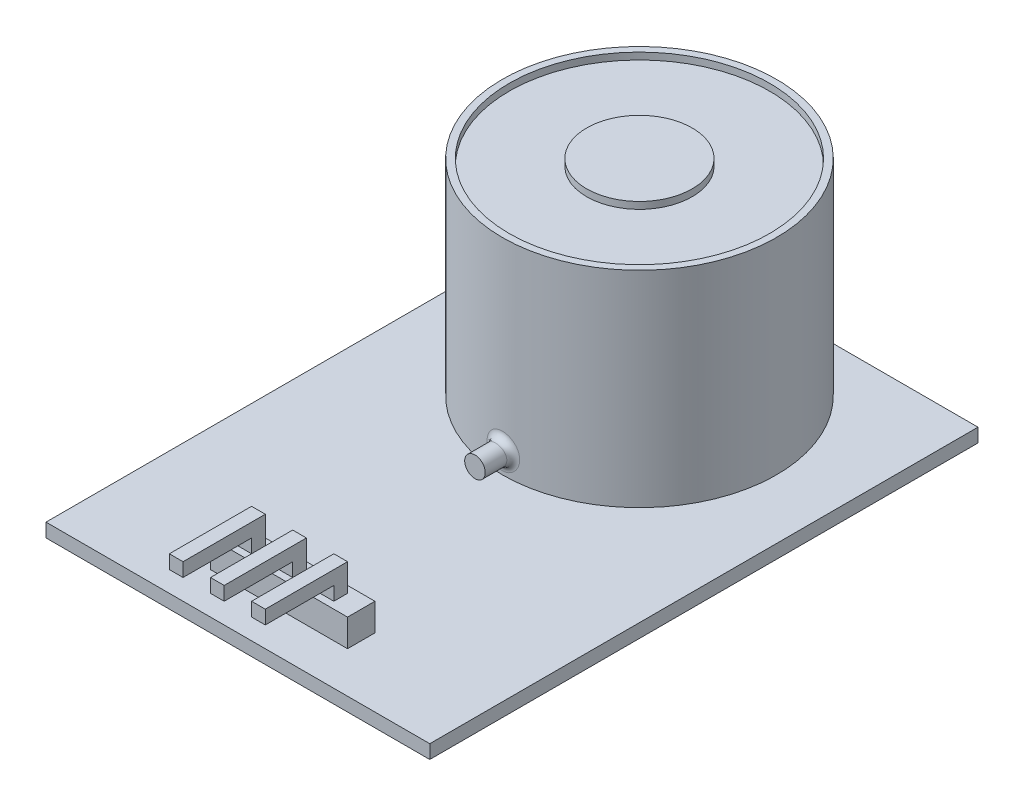
from build123d import *

# Parameters (mm, degrees)
ESQUISSE1_R             = 10
BOSS_EXTRU_1_DEPTH      = 15
ESQUISSE2_R             = 9.5
ESQUISSE2_R_2           = 3.85
ENL_V_MAT_EXTRU_1_DEPTH = 0.5
ESQUISSE3_R             = 0.75
BOSS_EXTRU_2_DEPTH      = 3
CONG_1_R                = 0.5
ESQUISSE4_W             = 28
ESQUISSE4_H             = 40
BOSS_EXTRU_3_DEPTH      = 1
ESQUISSE5_W             = 10
ESQUISSE5_H             = 2
BOSS_EXTRU_4_DEPTH      = 2
ESQUISSE6_W             = 1
ESQUISSE6_H             = 1
BOSS_EXTRU_5_DEPTH      = 2
ESQUISSE8_W             = 1
ESQUISSE8_H             = 1
BOSS_EXTRU_6_DEPTH      = 5


with BuildPart() as part:
    # Esquisse1 → Boss.-Extru.1 (new body)
    with BuildSketch(Plane(origin=(0, 0, 0), x_dir=(1, 0, 0), z_dir=(0, 1, 0))):
        with Locations(Location((0, 0, 0), (0, 0, 270))):
            Circle(ESQUISSE1_R)
    extrude(amount=BOSS_EXTRU_1_DEPTH)

    # Esquisse2 → Enlèv. mat.-Extru.1 (cut)
    with BuildSketch(Plane(origin=(0, 15, 0), x_dir=(1, 0, 0), z_dir=(0, 1, 0))):
        with Locations(Location((0, 0, 0), (0, 0, 270))):
            Circle(ESQUISSE2_R)
        with Locations(Location((0, 0, 0), (0, 0, 270))):
            Circle(ESQUISSE2_R_2, mode=Mode.SUBTRACT)
    extrude(amount=-ENL_V_MAT_EXTRU_1_DEPTH, mode=Mode.SUBTRACT)

    # Esquisse3 → Boss.-Extru.2 (add)
    with BuildSketch(Plane.XY.offset(9)):
        with Locations(Location((0, 1.513817118, 0), (0, 0, 180))):
            Circle(ESQUISSE3_R)
    extrude(amount=BOSS_EXTRU_2_DEPTH)

    # Congé1
    cong_1_edges = [part.edges().sort_by_distance(p)[0] for p in [
        (0.75, 1.513817118, 9.971835338),
    ]]
    fillet(cong_1_edges, radius=CONG_1_R)

    # Esquisse4 → Boss.-Extru.3 (add)
    with BuildSketch(Plane.XZ):
        with Locations((0.33364204, 9.631825749)):
            Rectangle(ESQUISSE4_W, ESQUISSE4_H)
    extrude(amount=BOSS_EXTRU_3_DEPTH)

    # Esquisse5 → Boss.-Extru.4 (add)
    with BuildSketch(Plane(origin=(0, 0, 0), x_dir=(1, 0, 0), z_dir=(0, 1, 0))):
        with Locations((0.33364204, -25.631825749)):
            Rectangle(ESQUISSE5_W, ESQUISSE5_H)
    extrude(amount=BOSS_EXTRU_4_DEPTH)

    # Esquisse6 → Boss.-Extru.5 (add)
    with BuildSketch(Plane(origin=(0, 2, 0), x_dir=(1, 0, 0), z_dir=(0, 1, 0))):
        with Locations((-2.66635796, -25.631825749)):
            Rectangle(ESQUISSE6_W, ESQUISSE6_H)
        with Locations((0.33364204, -25.631825749)):
            Rectangle(ESQUISSE6_W, ESQUISSE6_H)
        with Locations((3.33364204, -25.631825749)):
            Rectangle(ESQUISSE6_W, ESQUISSE6_H)
    extrude(amount=BOSS_EXTRU_5_DEPTH)

    # Esquisse8 → Boss.-Extru.6 (add)
    with BuildSketch(Plane.XY.offset(26.131825749)):
        with Locations((-2.66635796, 3.5)):
            Rectangle(ESQUISSE8_W, ESQUISSE8_H)
        with Locations((0.33364204, 3.5)):
            Rectangle(ESQUISSE8_W, ESQUISSE8_H)
        with Locations((3.33364204, 3.5)):
            Rectangle(ESQUISSE8_W, ESQUISSE8_H)
    extrude(amount=BOSS_EXTRU_6_DEPTH)


solid = part.part
